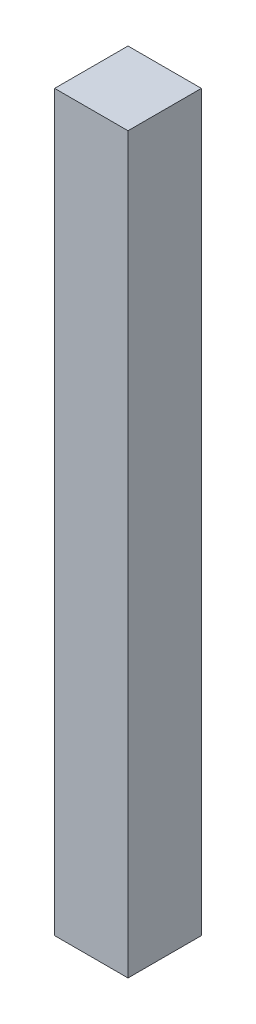
from build123d import *

# Parameters (mm, degrees)
SKETCH_1_W      = 20
SKETCH_1_H      = 20
EXTRUDE_1_DEPTH = 200


with BuildPart() as part:
    # 草圖1 → 填料-伸長1 (new body)
    with BuildSketch(Plane(origin=(0, 0, 0), x_dir=(1, 0, 0), z_dir=(0, 1, 0))):
        Rectangle(SKETCH_1_W, SKETCH_1_H)
    extrude(amount=EXTRUDE_1_DEPTH)


solid = part.part
